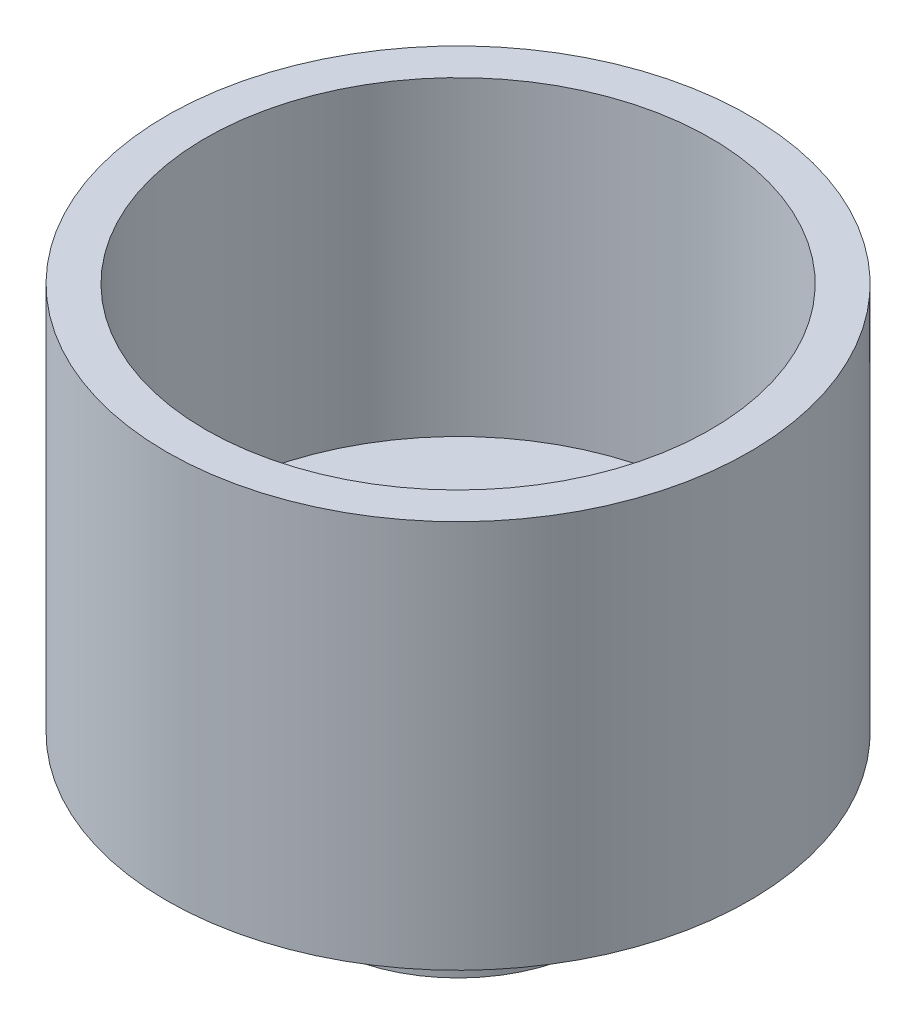
from build123d import *

# Parameters (mm, degrees)
SKETCH_1_R          = 37.5
EXTRUDE_1_DEPTH     = 50
SKETCH_2_R          = 32.5
CUT_EXTRUDE_1_DEPTH = 40
SKETCH_3_R          = 17.5
EXTRUDE_2_DEPTH     = 15
SKETCH_4_R          = 14.5
CUT_EXTRUDE_3_DEPTH = 84.889808678
SKETCH_6_R          = 3.5
CUT_EXTRUDE_4_DEPTH = 73.886898686
SKETCH_8_R          = 3.25
CUT_EXTRUDE_5_DEPTH = 73.886898686


with BuildPart() as part:
    # 草图1 → 凸台-拉伸1 (new body)
    with BuildSketch(Plane(origin=(0, 0, 0), x_dir=(1, 0, 0), z_dir=(0, 1, 0))):
        with Locations(Location((0, 0, 0), (0, 0, 270))):
            Circle(SKETCH_1_R)
    extrude(amount=EXTRUDE_1_DEPTH)

    # 草图2 → 切除-拉伸1 (cut)
    with BuildSketch(Plane(origin=(0, 50, 0), x_dir=(1, 0, 0), z_dir=(0, 1, 0))):
        with Locations(Location((0, 0, 0), (0, 0, 270))):
            Circle(SKETCH_2_R)
    extrude(amount=-CUT_EXTRUDE_1_DEPTH, mode=Mode.SUBTRACT)

    # 草图3 → 凸台-拉伸2 (add)
    with BuildSketch(Plane.XZ):
        with Locations(Location((0, 0, 0), (0, 0, 270))):
            Circle(SKETCH_3_R)
    extrude(amount=EXTRUDE_2_DEPTH)

    # 草图4 → 切除-拉伸3 (cut, through all)
    with BuildSketch(Plane(origin=(0, -15, 0), x_dir=(-1, 0, 0), z_dir=(0, -1, 0))):
        with Locations(Location((0, 0, 0), (0, 0, 90))):
            Circle(SKETCH_4_R)
    extrude(amount=-CUT_EXTRUDE_3_DEPTH, mode=Mode.SUBTRACT)

    # 草图6 → 切除-拉伸4 (cut, through all)
    with BuildSketch(Plane(origin=(0, 0, 0), x_dir=(-1, 0, 0), z_dir=(0, -1, 0))):
        with Locations(Location((-25.978212638, 0.984986916, 0), (0, 0, 90))):
            Circle(SKETCH_6_R)
    extrude(amount=-CUT_EXTRUDE_4_DEPTH, mode=Mode.SUBTRACT)

    # 草图8 → 切除-拉伸5 (cut, through all)
    with BuildSketch(Plane.XZ):
        with Locations(Location((-27.352744553, 0, 0), (0, 0, 270))):
            Circle(SKETCH_8_R)
    extrude(amount=-CUT_EXTRUDE_5_DEPTH, mode=Mode.SUBTRACT)


solid = part.part
